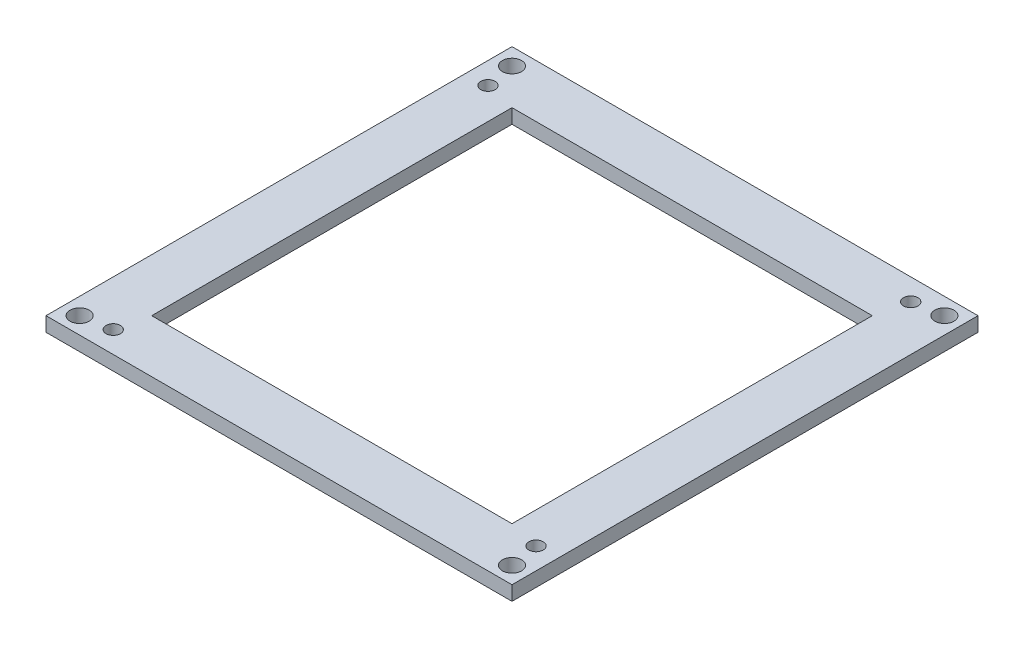
from build123d import *

# Parameters (mm, degrees)
SKETCH1_W           = 97
SKETCH1_H           = 97
BOSS_EXTRUDE1_DEPTH = 3
SKETCH2_R           = 1.5
CUT_EXTRUDE4_DEPTH  = 138.211515552
SKETCH3_W           = 75
SKETCH3_H           = 75
CUT_EXTRUDE5_DEPTH  = 7
SKETCH4_R           = 2
CUT_EXTRUDE6_DEPTH  = 10


with BuildPart() as part:
    # Sketch1 → Boss-Extrude1 (new body)
    with BuildSketch(Plane(origin=(0, 0, 0), x_dir=(1, 0, 0), z_dir=(0, 1, 0))):
        with Locations((48.5, 48.5)):
            Rectangle(SKETCH1_W, SKETCH1_H)
    extrude(amount=BOSS_EXTRUDE1_DEPTH)

    # Sketch2 → Cut-Extrude4 (cut, through all)
    with BuildSketch(Plane(origin=(0, 3, 0), x_dir=(1, 0, 0), z_dir=(0, 1, 0))):
        with Locations(Location((4.5, 87.5, 0), (0, 0, 270))):
            Circle(SKETCH2_R)
        with Locations(Location((87.5, 92.5, 0), (0, 0, 270))):
            Circle(SKETCH2_R)
        with Locations(Location((92.5, 9.5, 0), (0, 0, 270))):
            Circle(SKETCH2_R)
        with Locations(Location((9.5, 4.5, 0), (0, 0, 270))):
            Circle(SKETCH2_R)
    extrude(amount=-CUT_EXTRUDE4_DEPTH, mode=Mode.SUBTRACT)

    # Sketch3 → Cut-Extrude5 (cut)
    with BuildSketch(Plane(origin=(0, 3, 0), x_dir=(1, 0, 0), z_dir=(0, 1, 0))):
        with Locations((48.5, 48.5)):
            Rectangle(SKETCH3_W, SKETCH3_H)
    extrude(amount=-CUT_EXTRUDE5_DEPTH, mode=Mode.SUBTRACT)

    # Sketch4 → Cut-Extrude6 (cut)
    with BuildSketch(Plane(origin=(0, 3, 0), x_dir=(1, 0, 0), z_dir=(0, 1, 0))):
        with Locations(Location((93.5, 3.5, 0), (0, 0, 270))):
            Circle(SKETCH4_R)
        with Locations(Location((3.5, 93.5, 0), (0, 0, 270))):
            Circle(SKETCH4_R)
        with Locations(Location((93.5, 93.5, 0), (0, 0, 270))):
            Circle(SKETCH4_R)
        with Locations(Location((3.5, 3.5, 0), (0, 0, 270))):
            Circle(SKETCH4_R)
    extrude(amount=-CUT_EXTRUDE6_DEPTH, mode=Mode.SUBTRACT)


solid = part.part
